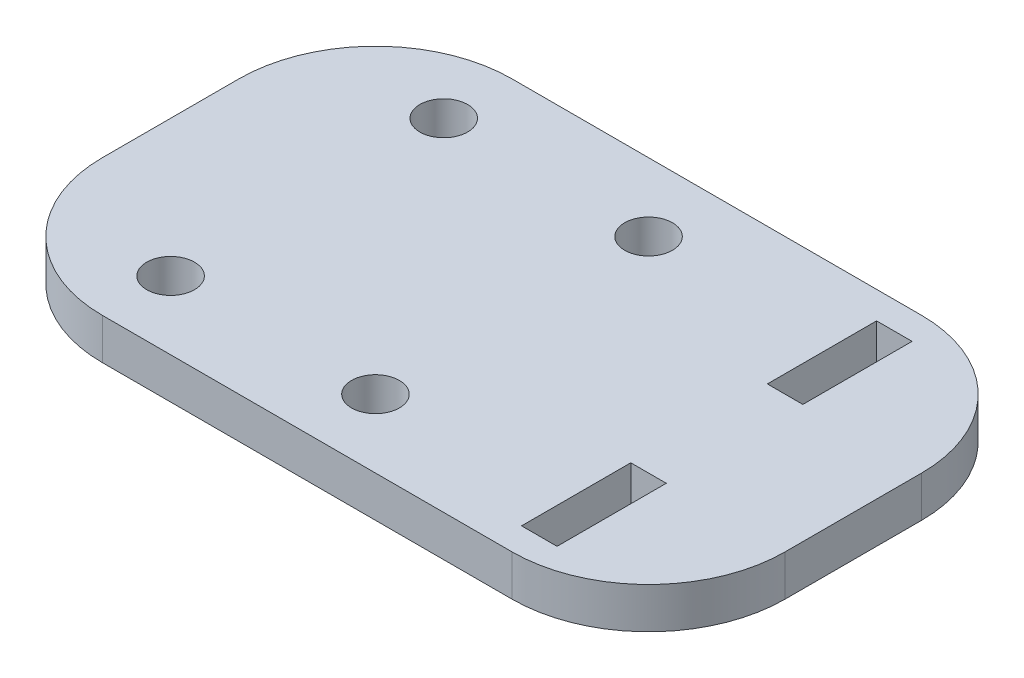
from build123d import *

# Parameters (mm, degrees)
SKETCH1_W           = 50
SKETCH1_H           = 30
SKETCH1_R           = 1.75
SKETCH1_W_2         = 2.6
SKETCH1_H_2         = 8
BOSS_EXTRUDE2_DEPTH = 3
FILLET1_R           = 10


with BuildPart() as part:
    # Sketch1 → Boss-Extrude2 (new body)
    with BuildSketch(Plane(origin=(0, 0, 0), x_dir=(1, 0, 0), z_dir=(0, 1, 0))):
        Rectangle(SKETCH1_W, SKETCH1_H)
        with Locations(Location((-15, 10, 0), (0, 0, 270))):
            Circle(SKETCH1_R, mode=Mode.SUBTRACT)
        with Locations(Location((0, 10, 0), (0, 0, 270))):
            Circle(SKETCH1_R, mode=Mode.SUBTRACT)
        with Locations(Location((-15, -10, 0), (0, 0, 90))):
            Circle(SKETCH1_R, mode=Mode.SUBTRACT)
        with Locations(Location((0, -10, 0), (0, 0, 90))):
            Circle(SKETCH1_R, mode=Mode.SUBTRACT)
        with Locations((15, -9)):
            Rectangle(SKETCH1_W_2, SKETCH1_H_2, mode=Mode.SUBTRACT)
        with Locations((15, 9)):
            Rectangle(SKETCH1_W_2, SKETCH1_H_2, mode=Mode.SUBTRACT)
    extrude(amount=BOSS_EXTRUDE2_DEPTH)

    # Fillet1
    fillet1_edges = [part.edges().sort_by_distance(p)[0] for p in [
        (-25, 1.5, -15),
        (25, 1.5, -15),
        (25, 1.5, 15),
        (-25, 1.5, 15),
    ]]
    fillet(fillet1_edges, radius=FILLET1_R)


solid = part.part
